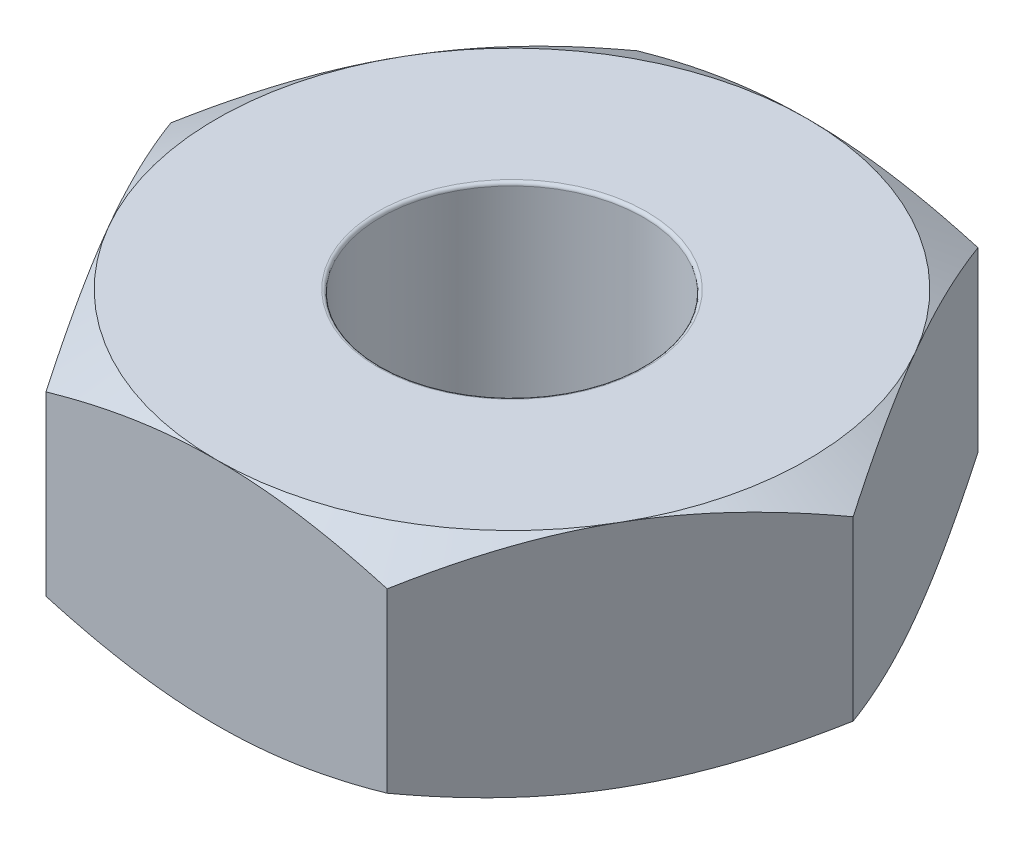
from build123d import *

# Parameters (mm, degrees)
SKETCH1_R           = 1
BOSS_EXTRUDE1_DEPTH = 1.75
SKETCH2_OUTSIDE_W   = 14.676
SKETCH2_OUTSIDE_H   = 13.98
SKETCH2_OUTSIDE_R   = 2.25
CUT_EXTRUDE1_DEPTH  = 1.75
CUT_EXTRUDE1_DRAFT  = -60
SKETCH3_OUTSIDE_W   = 14.676
SKETCH3_OUTSIDE_H   = 13.98
SKETCH3_OUTSIDE_R   = 2.25
CUT_EXTRUDE2_DEPTH  = 1.75
CUT_EXTRUDE2_DRAFT  = -60
FILLET1_R           = 0.025


with BuildPart() as part:
    # Sketch1 → Boss-Extrude1 (new body)
    with BuildSketch(Plane(origin=(0, 0, 0), x_dir=(1, 0, 0), z_dir=(0, 1, 0))):
        Polygon((1.299038106, -2.25), (2.598076211, 0), (1.299038106, 2.25), (-1.299038106, 2.25), (-2.598076211, 0), (-1.299038106, -2.25), align=None)
        with Locations(Location((0, 0, 0), (0, 0, 270))):
            Circle(SKETCH1_R, mode=Mode.SUBTRACT)
    extrude(amount=BOSS_EXTRUDE1_DEPTH)


with BuildPart() as cut_extrude1_tool:
    # Sketch2 outside → Cut-Extrude1 (with draft: the straight prism first)
    with BuildSketch(Plane(origin=(0, 1.75, 0), x_dir=(1, 0, 0), z_dir=(0, 1, 0))):
        Rectangle(SKETCH2_OUTSIDE_W, SKETCH2_OUTSIDE_H)
        Circle(SKETCH2_OUTSIDE_R, mode=Mode.SUBTRACT)
    extrude(amount=-CUT_EXTRUDE1_DEPTH)
    # Cut-Extrude1: the draft: its side faces are tilted about the plane it starts from
    cut_extrude1_sides = [cut_extrude1_tool.faces().sort_by_distance(p)[0] for p in [
        (0, 0.875, 6.99),
        (7.338, 0.875, 0),
        (0, 0.875, -6.99),
        (-7.338, 0.875, 0),
        (-2.25, 0.875, 0),
    ]]
    draft(cut_extrude1_sides, Plane(origin=(0, 1.75, 0), x_dir=(1, 0, 0), z_dir=(0, 1, 0)), CUT_EXTRUDE1_DRAFT)


with BuildPart() as part_1:
    add(part.part)

    # Cut-Extrude1: cut by cut_extrude1_tool
    add(cut_extrude1_tool.part, mode=Mode.SUBTRACT)


with BuildPart() as cut_extrude2_tool:
    # Sketch3 outside → Cut-Extrude2 (with draft: the straight prism first)
    with BuildSketch(Plane.XZ):
        Rectangle(SKETCH3_OUTSIDE_W, SKETCH3_OUTSIDE_H)
        Circle(SKETCH3_OUTSIDE_R, mode=Mode.SUBTRACT)
    extrude(amount=-CUT_EXTRUDE2_DEPTH)
    # Cut-Extrude2: the draft: its side faces are tilted about the plane it starts from
    cut_extrude2_sides = [cut_extrude2_tool.faces().sort_by_distance(p)[0] for p in [
        (0, 0.875, -6.99),
        (7.338, 0.875, 0),
        (0, 0.875, 6.99),
        (-7.338, 0.875, 0),
        (-2.25, 0.875, 0),
    ]]
    draft(cut_extrude2_sides, Plane.XZ, CUT_EXTRUDE2_DRAFT)


with BuildPart() as part_2:
    add(part_1.part)

    # Cut-Extrude2: cut by cut_extrude2_tool
    add(cut_extrude2_tool.part, mode=Mode.SUBTRACT)

    # Fillet1
    fillet1_edges = [part_2.edges().sort_by_distance(p)[0] for p in [
        (0, 0, -1),
        (0, 1.75, -1),
    ]]
    fillet(fillet1_edges, radius=FILLET1_R)


solid = part_2.part
